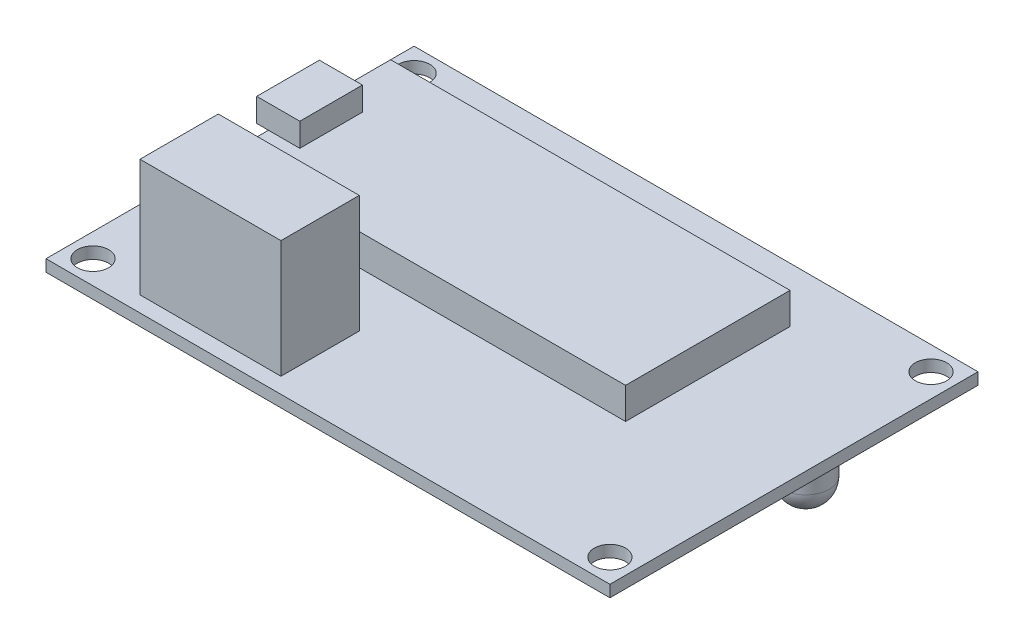
from build123d import *

# Parameters (mm, degrees)
SKETCH1_W           = 72
SKETCH1_H           = 47
BOSS_EXTRUDE1_DEPTH = 1.5
CUT_EXTRUDE1_DEPTH  = 1.5
SKETCH3_W           = 18
SKETCH3_H           = 10
BOSS_EXTRUDE2_DEPTH = 15
SKETCH4_W           = 51
SKETCH4_H           = 21
BOSS_EXTRUDE3_DEPTH = 4
SKETCH5_W           = 5.5
SKETCH5_H           = 8
BOSS_EXTRUDE4_DEPTH = 3
SKETCH6_R           = 3
BOSS_EXTRUDE5_DEPTH = 16
FILLET1_R           = 3


with BuildPart() as part:
    # Sketch1 → Boss-Extrude1 (new body)
    with BuildSketch(Plane(origin=(0, 0, 0), x_dir=(1, 0, 0), z_dir=(0, 1, 0))):
        with Locations((36, 23.5)):
            Rectangle(SKETCH1_W, SKETCH1_H)
    extrude(amount=BOSS_EXTRUDE1_DEPTH)

    # Sketch2 → Cut-Extrude1 (cut)
    with BuildSketch(Plane(origin=(0, 1.5, 0), x_dir=(1, 0, 0), z_dir=(0, 1, 0))):
        with BuildLine():
            ThreePointArc((67, 44), (67.585786438, 42.585786438), (69, 42))
            Line((69, 42), (69, 44))
            Line((69, 44), (67, 44))
        make_face()
        with BuildLine():
            Line((69, 44), (69, 42))
            ThreePointArc((69, 42), (70.414213562, 42.585786438), (71, 44))
            ThreePointArc((71, 44), (69, 46), (67, 44))
            Line((67, 44), (69, 44))
        make_face()
        with BuildLine():
            ThreePointArc((69, 5), (67.585786438, 4.414213562), (67, 3))
            Line((67, 3), (69, 3))
            Line((69, 3), (69, 5))
        make_face()
        with BuildLine():
            Line((69, 3), (67, 3))
            ThreePointArc((67, 3), (69, 1), (71, 3))
            ThreePointArc((71, 3), (70.414213562, 4.414213562), (69, 5))
            Line((69, 5), (69, 3))
        make_face()
        with BuildLine():
            Line((3, 5), (3, 3))
            Line((3, 3), (5, 3))
            ThreePointArc((5, 3), (4.414213562, 4.414213562), (3, 5))
        make_face()
        with BuildLine():
            Line((5, 3), (3, 3))
            Line((3, 3), (3, 5))
            ThreePointArc((3, 5), (1.585786438, 1.585786438), (5, 3))
        make_face()
        with BuildLine():
            ThreePointArc((5, 44), (1.585786438, 45.414213562), (3, 42))
            Line((3, 42), (3, 44))
            Line((3, 44), (5, 44))
        make_face()
        with BuildLine():
            Line((3, 44), (3, 42))
            ThreePointArc((3, 42), (4.414213562, 42.585786438), (5, 44))
            Line((5, 44), (3, 44))
        make_face()
    extrude(amount=-CUT_EXTRUDE1_DEPTH, mode=Mode.SUBTRACT)

    # Sketch3 → Boss-Extrude2 (add)
    with BuildSketch(Plane(origin=(0, 1.5, 0), x_dir=(1, 0, 0), z_dir=(0, 1, 0))):
        with Locations((19, 7)):
            Rectangle(SKETCH3_W, SKETCH3_H)
    extrude(amount=BOSS_EXTRUDE2_DEPTH)

    # Sketch4 → Boss-Extrude3 (add)
    with BuildSketch(Plane(origin=(0, 1.5, 0), x_dir=(1, 0, 0), z_dir=(0, 1, 0))):
        with Locations((29.5, 29.5)):
            Rectangle(SKETCH4_W, SKETCH4_H)
    extrude(amount=BOSS_EXTRUDE3_DEPTH)

    # Sketch5 → Boss-Extrude4 (add)
    with BuildSketch(Plane(origin=(0, 5.5, 0), x_dir=(1, 0, 0), z_dir=(0, 1, 0))):
        with Locations((5.25, 28.406225208)):
            Rectangle(SKETCH5_W, SKETCH5_H)
    extrude(amount=BOSS_EXTRUDE4_DEPTH)

    # Sketch6 → Boss-Extrude5 (add)
    with BuildSketch(Plane.XZ):
        with Locations(Location((58, -39, 0), (0, 0, 270))):
            Circle(SKETCH6_R)
    extrude(amount=BOSS_EXTRUDE5_DEPTH)

    # Fillet1
    fillet1_edges = [part.edges().sort_by_distance(p)[0] for p in [
        (58, -16, -36),
    ]]
    fillet(fillet1_edges, radius=FILLET1_R)


solid = part.part
